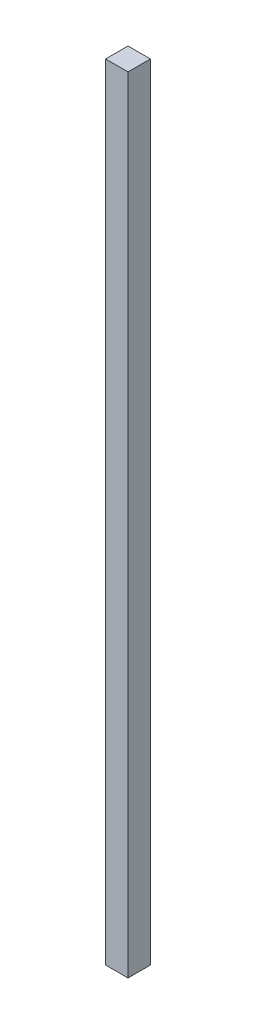
from build123d import *

# Parameters (mm, degrees)
ESQUISSE1_W        = 10
ESQUISSE1_H        = 10
BOSS_EXTRU_1_DEPTH = 350


with BuildPart() as part:
    # Esquisse1 → Boss.-Extru.1 (new body)
    with BuildSketch(Plane(origin=(0, 0, 0), x_dir=(1, 0, 0), z_dir=(0, 1, 0))):
        Rectangle(ESQUISSE1_W, ESQUISSE1_H)
    extrude(amount=BOSS_EXTRU_1_DEPTH)


solid = part.part
